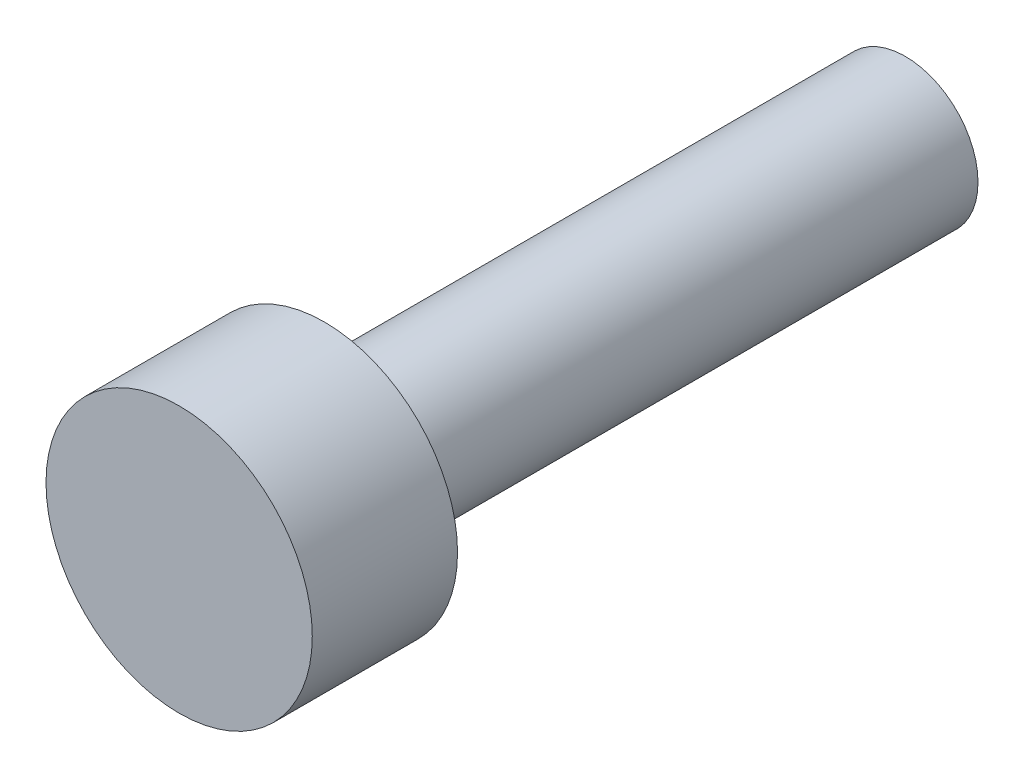
from build123d import *

# Parameters (mm, degrees)
SHANK_NOMINAL_THREAD_ENVELOPE_START     = -12
SHANK_NOMINAL_THREAD_ENVELOPE_PROFILE_R = 1.5
SHANK_NOMINAL_THREAD_ENVELOPE_DEPTH     = 12
SOCKET_HEAD_ENVELOPE_PROFILE_R          = 2.75
SOCKET_HEAD_ENVELOPE_DEPTH              = 3


with BuildPart() as part:
    # Shank_nominal_thread_envelope_profile → Shank_nominal_thread_envelope (new body)
    with BuildSketch(Plane.XY.offset(SHANK_NOMINAL_THREAD_ENVELOPE_START)):
        Circle(SHANK_NOMINAL_THREAD_ENVELOPE_PROFILE_R)
    extrude(amount=SHANK_NOMINAL_THREAD_ENVELOPE_DEPTH)

    # Socket_head_envelope_profile → Socket_head_envelope (add)
    with BuildSketch(Plane.XY):
        Circle(SOCKET_HEAD_ENVELOPE_PROFILE_R)
    extrude(amount=SOCKET_HEAD_ENVELOPE_DEPTH)


solid = part.part
